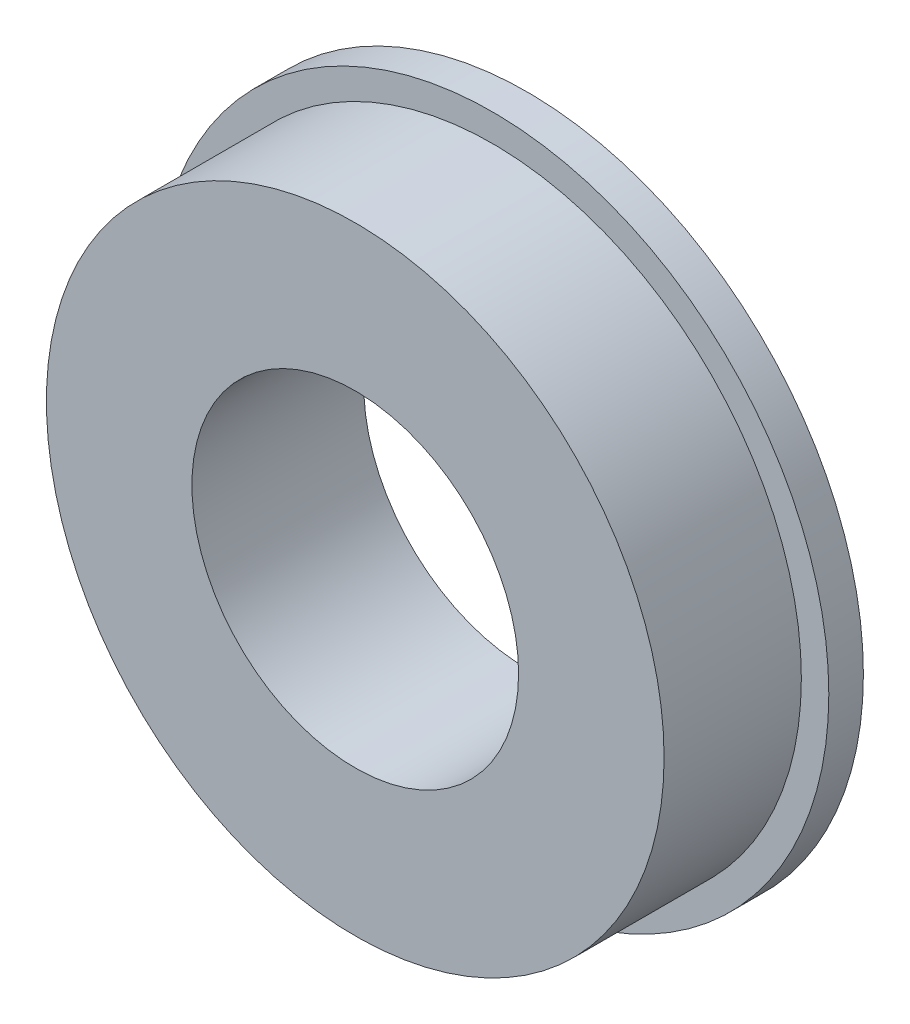
from build123d import *

# Parameters (mm, degrees)
SKETCH1_R           = 15.5575
BOSS_EXTRUDE1_DEPTH = 1.6002
SKETCH2_R           = 14.2875
BOSS_EXTRUDE2_DEPTH = 6.35
SKETCH3_R           = 7.5565
CUT_EXTRUDE1_DEPTH  = 24.393958462


with BuildPart() as part:
    # Sketch1 → Boss-Extrude1 (new body)
    with BuildSketch(Plane.XY):
        Circle(SKETCH1_R)
    extrude(amount=BOSS_EXTRUDE1_DEPTH)

    # Sketch2 → Boss-Extrude2 (add)
    with BuildSketch(Plane.XY.offset(1.6002)):
        Circle(SKETCH2_R)
    extrude(amount=BOSS_EXTRUDE2_DEPTH)

    # Sketch3 → Cut-Extrude1 (cut, through all)
    with BuildSketch(Plane.XY.offset(7.9502)):
        Circle(SKETCH3_R)
    extrude(amount=-CUT_EXTRUDE1_DEPTH, mode=Mode.SUBTRACT)


solid = part.part
